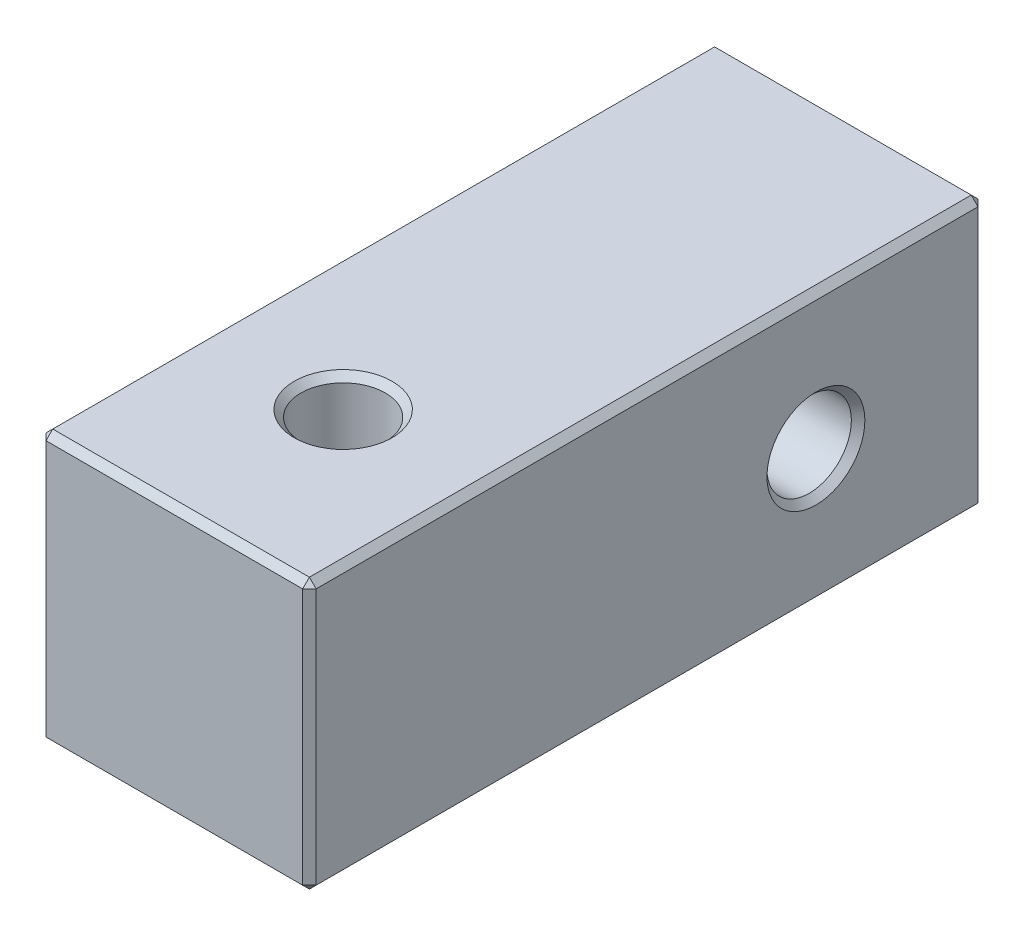
from build123d import *

# Parameters (mm, degrees)
SKETCH_1_W         = 8
SKETCH_1_H         = 8
EXTRUDE_1_DEPTH    = 10
HOLE_WIZARD_M3_1_D = 2.5
HOLE_WIZARD_M3_2_D = 2.5
CHAMFER_1_SIZE     = 0.2


with BuildPart() as part:
    # 草图1 → 凸台-拉伸1 (new, symmetric)
    with BuildSketch(Plane.XY):
        Rectangle(SKETCH_1_W, SKETCH_1_H)
    extrude(amount=EXTRUDE_1_DEPTH, both=True)

    # M3 螺纹孔1 (through all)
    with Locations(Plane(origin=(4, 0, 0), x_dir=(0, 0, -1), z_dir=(1, 0, 0))):
        with Locations((5, 0)):
            Hole(HOLE_WIZARD_M3_1_D / 2)

    # M3 螺纹孔2 (through all)
    with Locations(Plane(origin=(0, 4, 0), x_dir=(1, 0, 0), z_dir=(0, 1, 0))):
        with Locations((0, -5)):
            Hole(HOLE_WIZARD_M3_2_D / 2)

    # 倒角1
    chamfer_1_edges = [part.edges().sort_by_distance(p)[0] for p in [
        (-4, 0, 10),
        (4, 0, -6.25),
        (-4, 0, -6.25),
        (0, -4, 10),
        (1.25, 4, 5),
        (1.25, -4, 5),
        (4, 0, 10),
        (0, -4, -10),
        (-4, 0, -10),
        (0, 4, -10),
        (4, 0, -10),
        (4, -4, 0),
        (-4, -4, 0),
        (-4, 4, 0),
        (4, 4, 0),
        (0, 4, 10),
    ]]
    chamfer(chamfer_1_edges, length=CHAMFER_1_SIZE)


solid = part.part
